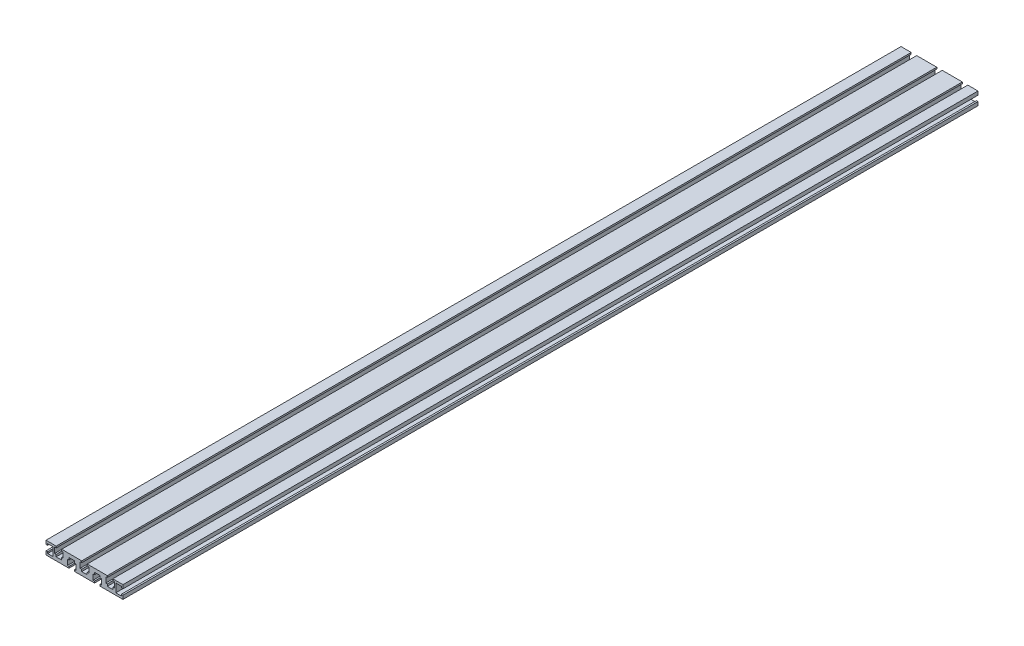
from build123d import *

# Parameters (mm, degrees)
EXTRUDE_1_DEPTH = 1000


with BuildPart() as part:
    # 草图1 → 凸台-拉伸1 (new body)
    with BuildSketch(Plane.XY):
        Polygon((-20.130003001, 1.051402525), (-18.330003001, 1.051402525), (-18.330003001, 3.551402525), (-11.930003001, 3.551402525), (-11.930003001, 1.051402525), (-10.130003001, 1.051402525), (-10.130003001, -5.448597475), (-11.930003001, -5.448597475), (-11.930003001, -7.348597475), (11.569996999, -7.348597475), (11.569996999, -5.448597475), (9.769996999, -5.448597475), (9.769996999, 1.051402525), (11.569996999, 1.051402525), (11.569996999, 3.551402525), (17.969996999, 3.551402525), (17.969996999, 1.051402525), (19.769996999, 1.051402525), (19.769996999, -5.448597475), (17.969996999, -5.448597475), (17.969996999, -7.348597475), (44.819996999, -7.348597475), (44.819996999, -3.048597475), (42.919996999, -3.048597475), (42.919996999, -4.848597475), (36.419996999, -4.848597475), (36.419996999, 5.151402525), (42.919996999, 5.151402525), (42.919996999, 3.351402525), (44.819996999, 3.351402525), (44.819996999, 7.651402525), (32.919996999, 7.651402525), (32.919996999, 5.751402525), (34.719996999, 5.751402525), (34.719996999, -0.748597475), (32.919996999, -0.748597475), (32.919996999, -3.248597475), (26.519996999, -3.248597475), (26.519996999, -0.748597475), (24.719996999, -0.748597475), (24.719996999, 5.751402525), (26.519996999, 5.751402525), (26.519996999, 7.651402525), (3.019996999, 7.651402525), (3.019996999, 5.751402525), (4.819996999, 5.751402525), (4.819996999, -0.748597475), (3.019996999, -0.748597475), (3.019996999, -3.248597475), (-3.380003001, -3.248597475), (-3.380003001, -0.748597475), (-5.180003001, -0.748597475), (-5.180003001, 5.751402525), (-3.380003001, 5.751402525), (-3.380003001, 7.651402525), (-26.880003001, 7.651402525), (-26.880003001, 5.751402525), (-25.080003001, 5.751402525), (-25.080003001, -0.748597475), (-26.880003001, -0.748597475), (-26.880003001, -3.248597475), (-33.280003001, -3.248597475), (-33.280003001, -0.748597475), (-35.080003001, -0.748597475), (-35.080003001, 5.751402525), (-33.280003001, 5.751402525), (-33.280003001, 7.651402525), (-45.180003001, 7.651402525), (-45.180003001, 3.351402525), (-43.280003001, 3.351402525), (-43.280003001, 5.151402525), (-36.780003001, 5.151402525), (-36.780003001, -4.848597475), (-43.280003001, -4.848597475), (-43.280003001, -3.048597475), (-45.180003001, -3.048597475), (-45.180003001, -7.348597475), (-18.330003001, -7.348597475), (-18.330003001, -5.448597475), (-20.130003001, -5.448597475), align=None)
    extrude(amount=EXTRUDE_1_DEPTH)


solid = part.part
